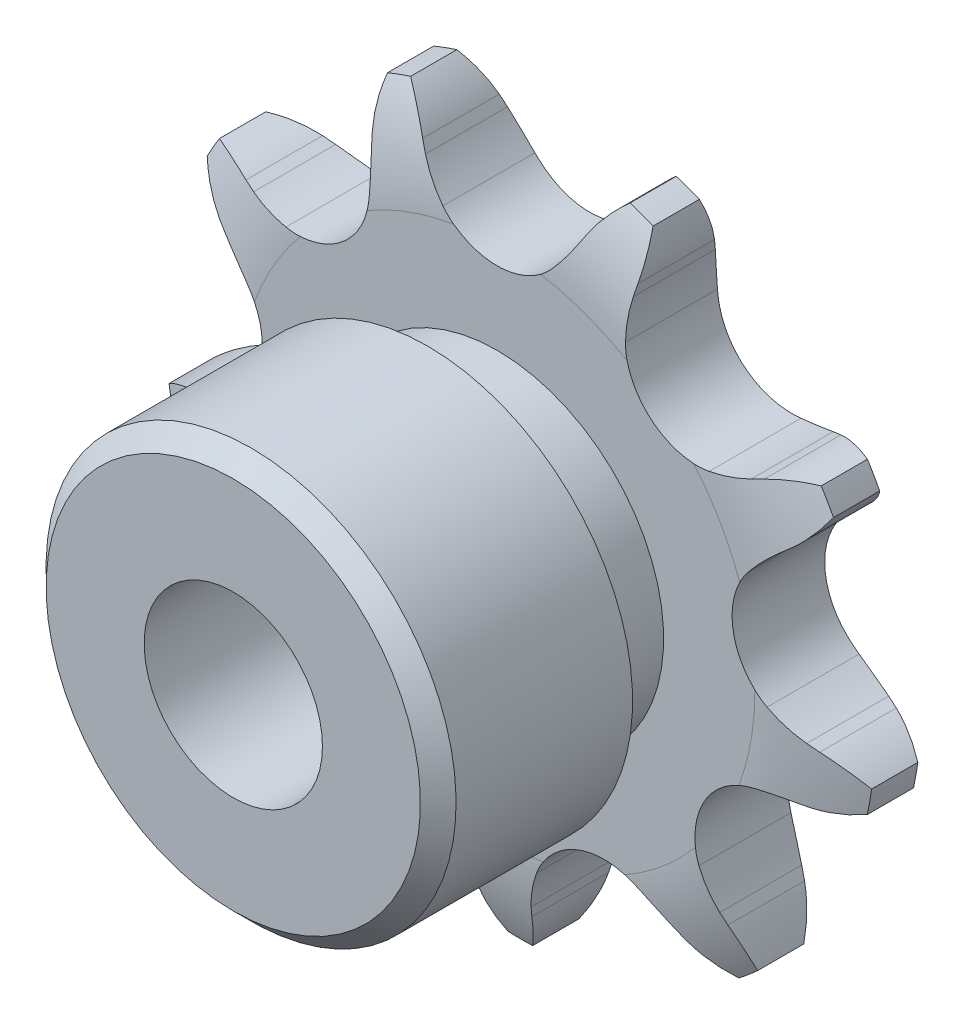
from build123d import *

# Parameters (mm, degrees)
CUT_EXTRUDE1_DEPTH      = 15.261517848
CIRPATTERN1_COUNT       = 9
BOSS_EXTRUDE1_START     = 1.3
SKETCH2_R               = 5.75
BOSS_EXTRUDE1_DEPTH     = 7.4
CUT_EXTRUDE2_DEPTH      = 17.591034702
CUT_EXTRUDE2_DEPTH_BACK = 17.591034702
SKETCH3_R               = 2.5
SKETCH4_W               = 1.95
SKETCH4_H               = 5.371019058
CUT_EXTRUDE3_DEPTH      = 17.591034702
CUT_EXTRUDE3_DEPTH_BACK = 17.591034702
SKETCH5_OUTSIDE_W       = 27.798
SKETCH5_OUTSIDE_H       = 27.5
SKETCH5_OUTSIDE_R       = 9.95


with BuildPart() as part:
    # Sketch1 → Revolve1 (revolve)
    with BuildSketch(Plane(origin=(0, 0, 0), x_dir=(0, 0, -1), z_dir=(1, 0, 0))):
        with BuildLine():
            Line((1.3, 0), (-1.3, 0))
            Line((-1.3, 0), (-1.3, 7.229960036))
            ThreePointArc((-1.3, 7.229960036), (-1.122370651, 8.679097711), (-0.6, 10.042432258))
            Line((-0.6, 10.042432258), (0.6, 10.042432258))
            ThreePointArc((0.6, 10.042432258), (1.122370651, 8.679097711), (1.3, 7.229960036))
            Line((1.3, 7.229960036), (1.3, 0))
        make_face()
    revolve(axis=Axis((0, 0, -1.3), (0, 0, 1)))

    # Sketch0 → Cut-Extrude1 (cut, symmetric)
    with BuildSketch(Plane.XY):
        with BuildLine():
            Line((5.098468609, -7.244145344), (4.862482466, -7.045348332))
            ThreePointArc((4.862482466, -7.045348332), (4.432831877, -6.719619585), (3.972029017, -6.439691789))
            ThreePointArc((3.972029017, -6.439691789), (2.299508544, -6.317847802), (1.096603336, -7.486261148))
            ThreePointArc((1.096603336, -7.486261148), (0.923541984, -7.996896649), (0.803784941, -8.522593421))
            Line((0.803784941, -8.522593421), (0.750793323, -8.826569736))
            ThreePointArc((0.750793323, -8.826569736), (-0.832851059, -11.14866988), (-3.623218265, -11.486204271))
            ThreePointArc((-3.623218265, -11.486204271), (4.11932842, -11.317761816), (10.158736006, -6.469983147))
            ThreePointArc((10.158736006, -6.469983147), (7.804227789, -8.005030268), (5.098468609, -7.244145344))
        make_face()
    cut_extrude1 = extrude(amount=CUT_EXTRUDE1_DEPTH, both=True, mode=Mode.SUBTRACT)

    # CirPattern1: Cut-Extrude1 ×9 about axis
    cirpattern1_axis = Axis((0, 0, 0), (0, 0, 1))
    for i in range(1, CIRPATTERN1_COUNT):
        add(cut_extrude1.rotate(cirpattern1_axis, i * 360 / CIRPATTERN1_COUNT), mode=Mode.SUBTRACT)

    # Sketch2 → Boss-Extrude1 (add)
    with BuildSketch(Plane.XY.offset(BOSS_EXTRUDE1_START)):
        with Locations(Location((0, 0, 0), (0, 0, 270))):
            Circle(SKETCH2_R)
    extrude(amount=BOSS_EXTRUDE1_DEPTH)

    # Sketch3 → Cut-Extrude2 (cut, two sides: drawn at the far end of the back side and taken through both)
    with BuildSketch(Plane.XY.offset(-CUT_EXTRUDE2_DEPTH_BACK)):
        Circle(SKETCH3_R)
    extrude(amount=CUT_EXTRUDE2_DEPTH + CUT_EXTRUDE2_DEPTH_BACK, mode=Mode.SUBTRACT)

    # Sketch4 → Cut-Revolve1 (revolve, cut)
    with BuildSketch(Plane(origin=(0, 0, 0), x_dir=(0, 0, -1), z_dir=(1, 0, 0))):
        Polygon((-8.7, 5.75), (-8.7, 5.25), (-8.2, 5.75), align=None)
        with Locations((-2.275, 7.356922729)):
            Rectangle(SKETCH4_W, SKETCH4_H)
    revolve(axis=Axis((0, 0, -1.3), (0, 0, 1)), mode=Mode.SUBTRACT)

    # Sketch5 outside → Cut-Extrude3 (cut, two sides: drawn at the far end of the back side and taken through both)
    with BuildSketch(Plane.XY.offset(-CUT_EXTRUDE3_DEPTH_BACK)):
        with Locations((0, -0.255)):
            Rectangle(SKETCH5_OUTSIDE_W, SKETCH5_OUTSIDE_H)
        Circle(SKETCH5_OUTSIDE_R, mode=Mode.SUBTRACT)
    extrude(amount=CUT_EXTRUDE3_DEPTH + CUT_EXTRUDE3_DEPTH_BACK, mode=Mode.SUBTRACT)


solid = part.part
